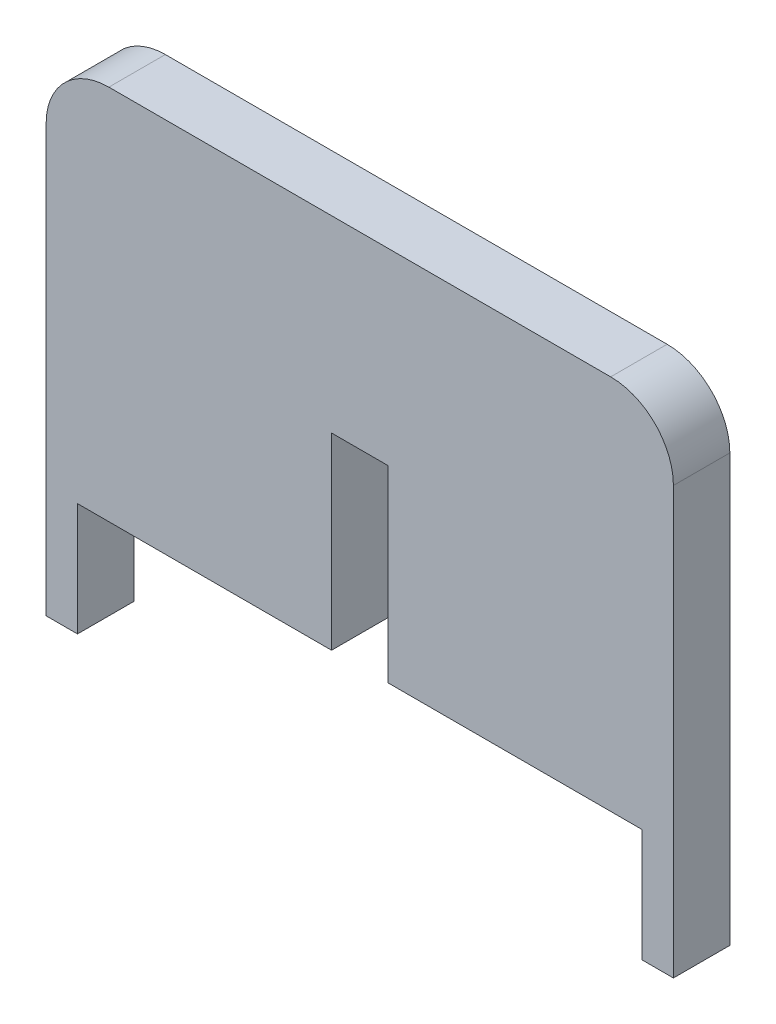
from build123d import *

# Parameters (mm, degrees)
SKETCH1_W           = 2.5
SKETCH1_H           = 9
SKETCH1_W_2         = 4.5
SKETCH1_H_2         = 15
BOSS_EXTRUDE1_DEPTH = 4.5
FILLET1_R           = 5


with BuildPart() as part:
    # Sketch1 → Boss-Extrude1 (new body)
    with BuildSketch(Plane.XY):
        Polygon((-2.25, -15), (-2.25, 0), (-2.25, 15), (-25, 15), (-25, -15), (-22.5, -15), align=None)
        Polygon((2.25, 15), (2.25, 0), (2.25, -15), (22.5, -15), (25, -15), (25, 15), align=None)
        with Locations((-23.75, -19.5)):
            Rectangle(SKETCH1_W, SKETCH1_H)
        with Locations((23.75, -19.5)):
            Rectangle(SKETCH1_W, SKETCH1_H)
        with Locations((0, 7.5)):
            Rectangle(SKETCH1_W_2, SKETCH1_H_2)
    extrude(amount=BOSS_EXTRUDE1_DEPTH)

    # Fillet1
    fillet1_edges = [part.edges().sort_by_distance(p)[0] for p in [
        (-25, 15, 2.25),
        (25, 15, 2.25),
    ]]
    fillet(fillet1_edges, radius=FILLET1_R)


solid = part.part
